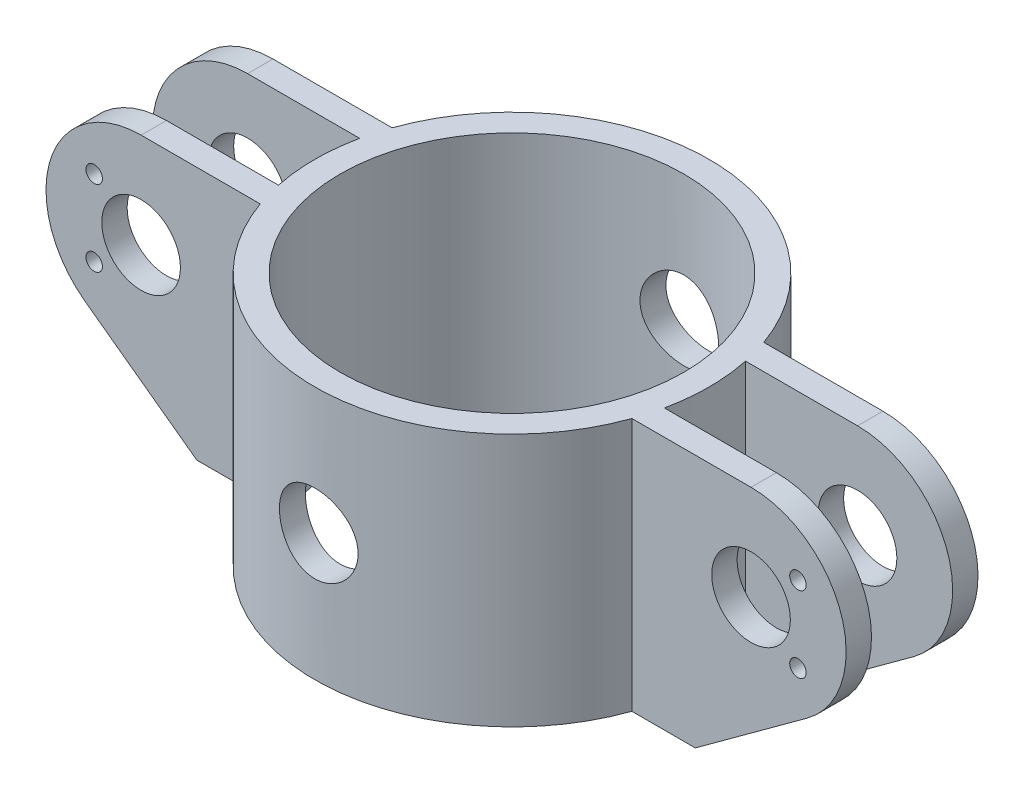
from build123d import *

# Parameters (mm, degrees)
SKETCH_1_R          = 155.5
SKETCH_1_R_2        = 135.5
EXTRUDE_1_DEPTH     = 200
SKETCH_2_R          = 31
CUT_EXTRUDE_1_DEPTH = 703.75209
SKETCH_3_W          = 200
SKETCH_3_H          = 20
EXTRUDE_2_DEPTH     = 200
SKETCH_4_R          = 31
CUT_EXTRUDE_2_DEPTH = 451.72342916
SKETCH_5_R          = 6.5
CUT_EXTRUDE_3_DEPTH = 20


with BuildPart() as part:
    # 草图1 → 凸台-拉伸1 (new body)
    with BuildSketch(Plane(origin=(0, 0, 0), x_dir=(1, 0, 0), z_dir=(0, 1, 0))):
        with Locations(Location((0, 0, 0), (0, 0, 270))):
            Circle(SKETCH_1_R)
        with Locations(Location((0, 0, 0), (0, 0, 270))):
            Circle(SKETCH_1_R_2, mode=Mode.SUBTRACT)
    extrude(amount=EXTRUDE_1_DEPTH)

    # 草图2 → 切除-拉伸1 (cut, through all)
    with BuildSketch(Plane.XY.offset(500)):
        with Locations((0, 100)):
            Circle(SKETCH_2_R)
    extrude(amount=-CUT_EXTRUDE_1_DEPTH, mode=Mode.SUBTRACT)

    # 草图3 → 凸台-拉伸2 (add)
    with BuildSketch(Plane(origin=(0, 200, 0), x_dir=(1, 0, 0), z_dir=(0, 1, 0))):
        with Locations((246.54777378, 42)):
            Rectangle(SKETCH_3_W, SKETCH_3_H)
        with Locations((246.54777378, -42)):
            Rectangle(SKETCH_3_W, SKETCH_3_H)
        with Locations((-246.54777378, 42)):
            Rectangle(SKETCH_3_W, SKETCH_3_H)
        with Locations((-246.54777378, -42)):
            Rectangle(SKETCH_3_W, SKETCH_3_H)
    extrude(amount=-EXTRUDE_2_DEPTH)

    # 草图4 → 切除-拉伸2 (cut, through all)
    with BuildSketch(Plane.XY.offset(52)):
        with Locations((-240.5, 125)):
            Circle(SKETCH_4_R)
        with Locations((240.5, 125)):
            Circle(SKETCH_4_R)
        with BuildLine():
            Line((284.746447685, 64.442160976), (196.54777378, 0))
            Line((196.54777378, 0), (346.54777378, 0))
            Line((346.54777378, 0), (346.54777378, 200))
            Line((346.54777378, 200), (240.5, 200))
            ThreePointArc((240.5, 200), (311.798099297, 148.271893704), (284.746447685, 64.442160976))
        make_face()
        with BuildLine():
            Line((-284.746447685, 64.442160976), (-196.54777378, 0))
            Line((-196.54777378, 0), (-346.54777378, 0))
            Line((-346.54777378, 0), (-346.54777378, 200))
            Line((-346.54777378, 200), (-240.5, 200))
            ThreePointArc((-240.5, 200), (-311.798099297, 148.271893704), (-284.746447685, 64.442160976))
        make_face()
    extrude(amount=-CUT_EXTRUDE_2_DEPTH, mode=Mode.SUBTRACT)

    # 草图5 → 切除-拉伸3 (cut)
    with BuildSketch(Plane.XY.offset(52)):
        with Locations((277.5, 155)):
            Circle(SKETCH_5_R)
        with Locations((277.5, 95)):
            Circle(SKETCH_5_R)
        with Locations((-277.5, 155)):
            Circle(SKETCH_5_R)
        with Locations((-277.5, 95)):
            Circle(SKETCH_5_R)
    extrude(amount=-CUT_EXTRUDE_3_DEPTH, mode=Mode.SUBTRACT)


solid = part.part
